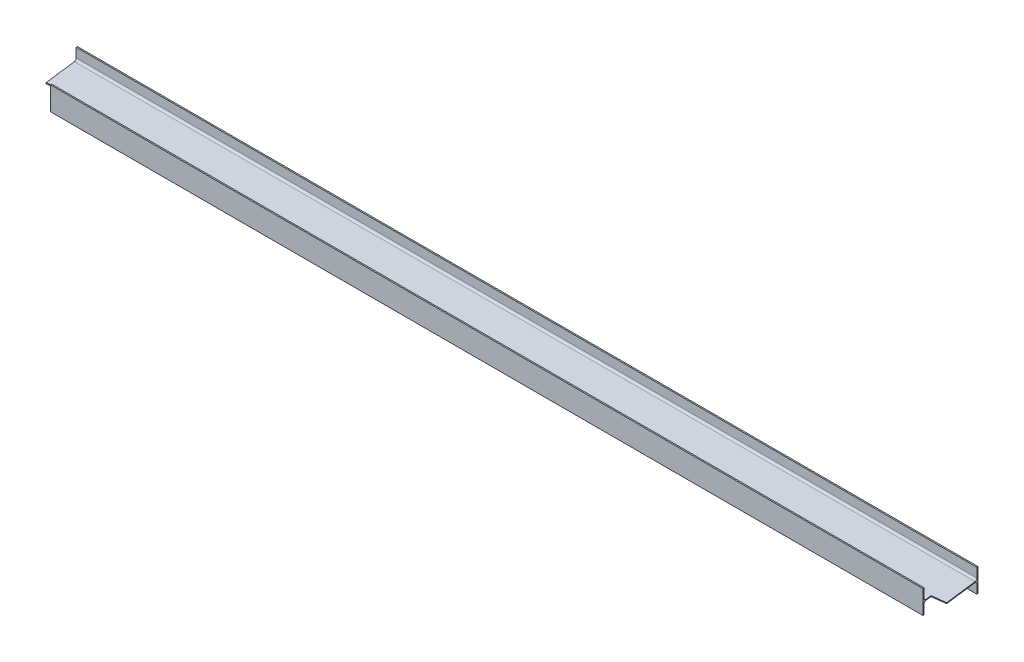
from build123d import *

# Parameters (mm, degrees)
MEMBER_30_1_1_DEPTH      = 5791
CUT_EXTRUDE_1_DEPTH      = 5795.832439338
CUT_EXTRUDE_2_DEPTH      = 5794.431587798
CUT_EXTRUDE_2_DEPTH_BACK = 5794.431587798


with BuildPart() as part:
    # Sketch11 → Member 30_1_1 (new body)
    with BuildSketch(Plane.YZ):
        with BuildLine():
            Line((-15.75, -141), (-74.5, -141))
            Line((-74.5, -141), (-74.5, -149))
            Line((-74.5, -149), (74.5, -149))
            Line((74.5, -149), (74.5, -141))
            Line((74.5, -141), (15.75, -141))
            ThreePointArc((15.75, -141), (6.557611845, -137.192388155), (2.75, -128))
            Line((2.75, -128), (2.75, 128))
            ThreePointArc((2.75, 128), (6.557611845, 137.192388155), (15.75, 141))
            Line((15.75, 141), (74.5, 141))
            Line((74.5, 141), (74.5, 149))
            Line((74.5, 149), (-74.5, 149))
            Line((-74.5, 149), (-74.5, 141))
            Line((-74.5, 141), (-15.75, 141))
            ThreePointArc((-15.75, 141), (-6.557611845, 137.192388155), (-2.75, 128))
            Line((-2.75, 128), (-2.75, -128))
            ThreePointArc((-2.75, -128), (-6.557611845, -137.192388155), (-15.75, -141))
        make_face()
    extrude(amount=MEMBER_30_1_1_DEPTH)

    # Эскиз3 → Вырез-Вытянуть1 (cut, through all)
    with BuildSketch(Plane(origin=(0, 74.5, 0), x_dir=(1, 0, 0), z_dir=(0, 1, 0))):
        Polygon((0, -149), (0, 149), (37.25, -149), align=None)
        Polygon((5791, -149), (5791, 149), (5753.75, 149), align=None)
    extrude(amount=-CUT_EXTRUDE_1_DEPTH, mode=Mode.SUBTRACT)

    # Эскиз5 → Вырез-Вытянуть2 (cut, two sides: drawn at the far end of the back side and taken through both)
    with BuildSketch(Plane(origin=(0, 2.75, 0), x_dir=(1, 0, 0), z_dir=(0, 1, 0)).offset(-CUT_EXTRUDE_2_DEPTH_BACK)):
        Polygon((28.567568579, -79.54054863), (117.872577483, -68.377422517), (127.950399668, -149), (37.25, -149), align=None)
        Polygon((5782.317568579, -79.54054863), (5693.012559675, -90.703674743), (5700.299600332, -149), (5791, -149), align=None)
    extrude(amount=CUT_EXTRUDE_2_DEPTH + CUT_EXTRUDE_2_DEPTH_BACK, mode=Mode.SUBTRACT)


solid = part.part
